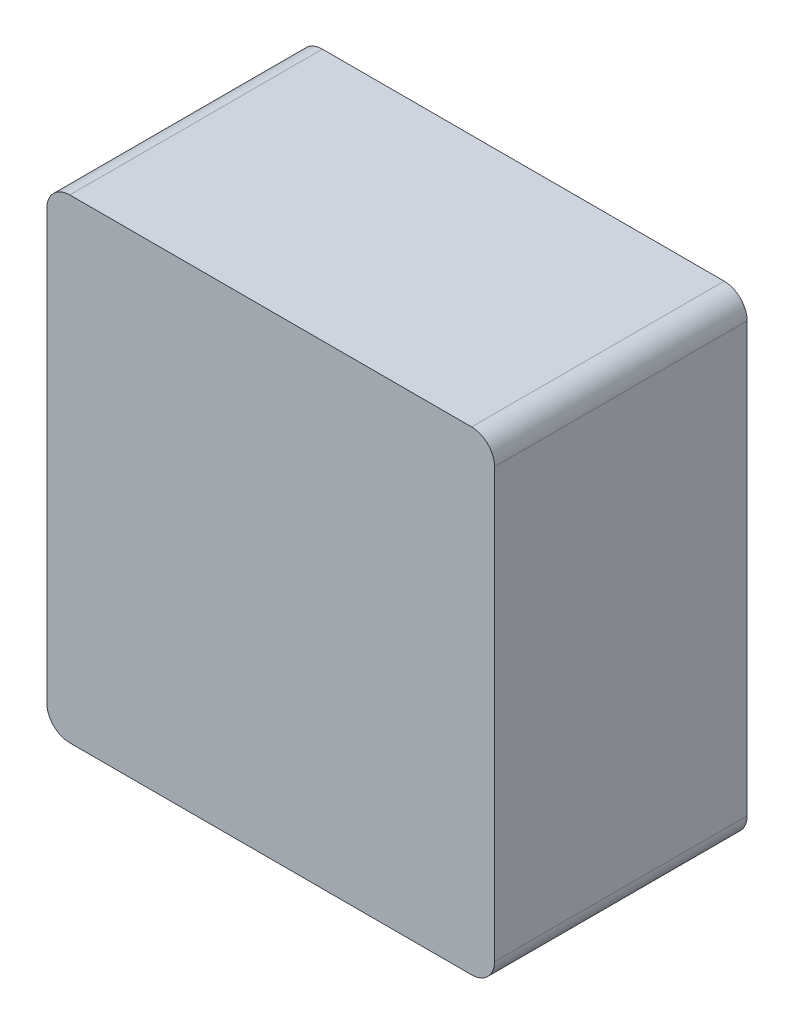
from build123d import *

# Parameters (mm, degrees)
SKETCH_1_W      = 54.3
SKETCH_1_H      = 57.8
EXTRUDE_1_DEPTH = 30
EXTRUDE_2_DEPTH = 3
FILLET_1_R      = 2.5


with BuildPart() as part:
    # Эскиз1 → Бобышка-Вытянуть1 (new body)
    with BuildSketch(Plane.XY.offset(-7)):
        with BuildLine():
            Line((-26.25, -31), (26.25, -31))
            ThreePointArc((26.25, -31), (28.371320344, -30.121320344), (29.25, -28))
            Line((29.25, -28), (29.25, 28))
            ThreePointArc((29.25, 28), (28.371320344, 30.121320344), (26.25, 31))
            Line((26.25, 31), (-26.25, 31))
            ThreePointArc((-26.25, 31), (-28.371320344, 30.121320344), (-29.25, 28))
            Line((-29.25, 28), (-29.25, -28))
            ThreePointArc((-29.25, -28), (-28.371320344, -30.121320344), (-26.25, -31))
        make_face()
        Rectangle(SKETCH_1_W, SKETCH_1_H, mode=Mode.SUBTRACT)
    extrude(amount=EXTRUDE_1_DEPTH)

    # Эскиз2 → Бобышка-Вытянуть2 (add)
    with BuildSketch(Plane.XY.offset(23)):
        with BuildLine():
            Line((-26.25, -31), (26.25, -31))
            ThreePointArc((26.25, -31), (28.371320344, -30.121320344), (29.25, -28))
            Line((29.25, -28), (29.25, 28))
            ThreePointArc((29.25, 28), (28.371320344, 30.121320344), (26.25, 31))
            Line((26.25, 31), (-26.25, 31))
            ThreePointArc((-26.25, 31), (-28.371320344, 30.121320344), (-29.25, 28))
            Line((-29.25, 28), (-29.25, -28))
            ThreePointArc((-29.25, -28), (-28.371320344, -30.121320344), (-26.25, -31))
        make_face()
    extrude(amount=EXTRUDE_2_DEPTH)

    # Скругление1
    fillet_1_edges = [part.edges().sort_by_distance(p)[0] for p in [
        (0, 28.9, 23),
        (-27.15, 0, 23),
        (0, -28.9, 23),
        (27.15, 0, 23),
    ]]
    fillet(fillet_1_edges, radius=FILLET_1_R)


solid = part.part
